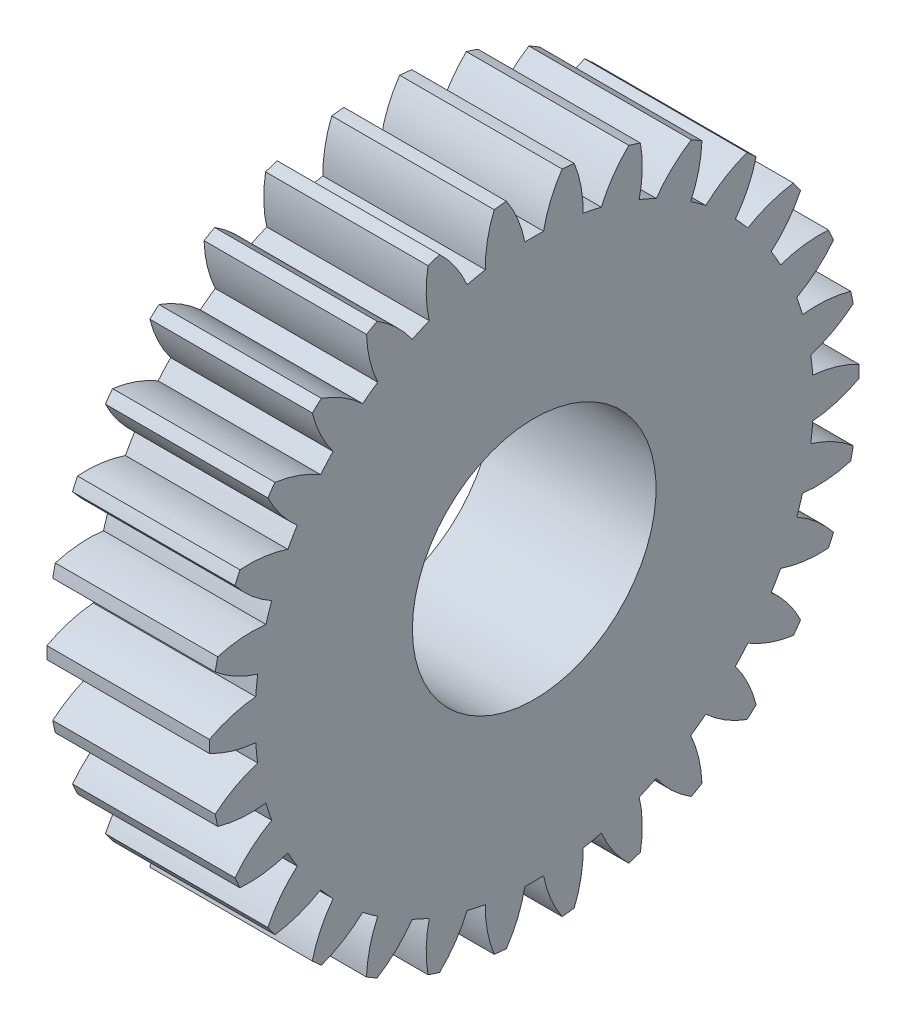
from build123d import *

# Parameters (mm, degrees)
BASPROSKE_W     = 16
BASPROSKE_H     = 32
TOOTHCUT_DEPTH  = 49
TEETHCUTS_COUNT = 30
TEETHCUTS_ANGLE = 348
BORSKE_R        = 12
BORE_DEPTH      = 50.0000508


with BuildPart() as part:
    # BasProSke → Base-Revolve (revolve)
    with BuildSketch(Plane(origin=(0, 0, 0), x_dir=(1, 0, 0), z_dir=(0, 1, 0)), mode=Mode.PRIVATE) as base_revolve_sk:
        with Locations((8, 16)):
            Rectangle(BASPROSKE_W, BASPROSKE_H)
    revolve(base_revolve_sk.sketch.rotate(Axis((-10, 0, 0), (1, 0, 0)), 180), axis=Axis((-10, 0, 0), (1, 0, 0)))

    # TooCutSke → ToothCut (cut, through all)
    with BuildSketch(Plane(origin=(0, 0, 0), x_dir=(0, 0, -1), z_dir=(1, 0, 0))):
        with BuildLine():
            ThreePointArc((0.918551563, 27.483654488), (0, 27.499), (-0.918551563, 27.483654488))
            ThreePointArc((-0.918551563, 27.483654488), (-1.617208176, 29.787801627), (-2.761784709, 31.906093311))
            ThreePointArc((-2.761784709, 31.906093311), (0, 32.0254), (2.761784709, 31.906093311))
            ThreePointArc((2.761784709, 31.906093311), (1.617208176, 29.787801627), (0.918551563, 27.483654488))
        make_face()
    toothcut = extrude(amount=TOOTHCUT_DEPTH, mode=Mode.SUBTRACT)

    # TeethCuts: ToothCut ×30 about axis
    teethcuts_axis = Axis((-10, 0, 0), (1, 0, 0))
    for i in range(1, TEETHCUTS_COUNT):
        add(toothcut.rotate(teethcuts_axis, i * TEETHCUTS_ANGLE / (TEETHCUTS_COUNT - 1)), mode=Mode.SUBTRACT)

    # BorSke → Bore (cut, symmetric)
    with BuildSketch(Plane(origin=(0, 0, 0), x_dir=(0, 0, -1), z_dir=(1, 0, 0))):
        with Locations(Location((0, 0, 0), (0, 0, 180))):
            Circle(BORSKE_R)
    extrude(amount=BORE_DEPTH, both=True, mode=Mode.SUBTRACT)


solid = part.part
